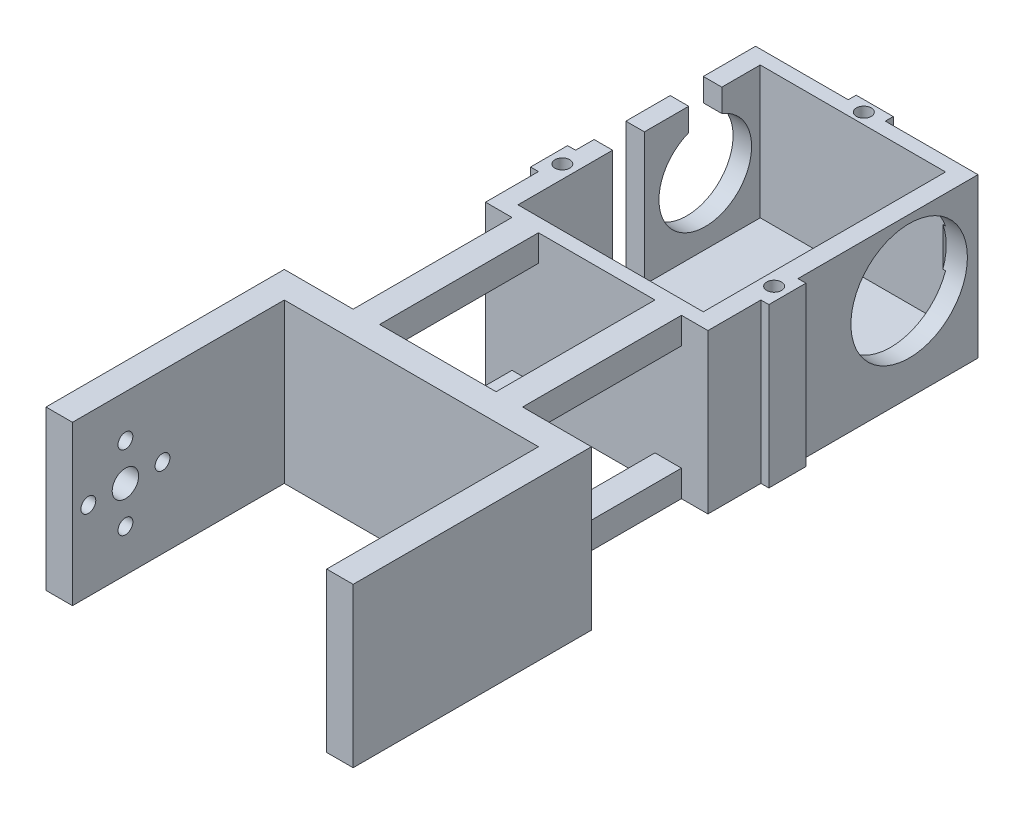
from build123d import *

# Parameters (mm, degrees)
BOSS_EXTRUDE1_DEPTH = 5
SKETCH3_W           = 42
SKETCH3_H           = 51
SKETCH3_W_2         = 35
SKETCH3_H_2         = 45.75
BOSS_EXTRUDE3_DEPTH = 25
SKETCH4_R           = 8.75
CUT_EXTRUDE2_DEPTH  = 5
CUT_EXTRUDE3_DEPTH  = 4
SKETCH7_W           = 6
SKETCH7_H           = 25
CUT_EXTRUDE4_DEPTH  = 4
SKETCH9_R           = 11
CUT_EXTRUDE5_DEPTH  = 4
SKETCH16_W          = 7
SKETCH16_H          = 30
BOSS_EXTRUDE5_DEPTH = 1.5
SKETCH17_W          = 7
SKETCH17_H          = 30
BOSS_EXTRUDE6_DEPTH = 1.5
SKETCH19_W          = 7
SKETCH19_H          = 30
BOSS_EXTRUDE7_DEPTH = 1.5
SKETCH18_R          = 1.4
CUT_EXTRUDE7_DEPTH  = 6
SKETCH1_3_W         = 5
SKETCH1_3_H         = 30
SKETCH1_3_H_2       = 40
BOSS_EXTRUDE8_DEPTH = 30
SKETCH21_R          = 2.95
BOSS_EXTRUDE9_DEPTH = 4
SKETCH24_W          = 30
SKETCH24_H          = 20
CUT_EXTRUDE8_DEPTH  = 32
SKETCH25_R          = 2.5
SKETCH25_R_2        = 1.4
CUT_EXTRUDE9_DEPTH  = 5


with BuildPart() as part:
    # Sketch1 → Boss-Extrude1 (new body)
    with BuildSketch(Plane(origin=(0, 0, 0), x_dir=(1, 0, 0), z_dir=(0, 1, 0))):
        Polygon((21, 25.5), (-21, 25.5), (-21, -25.5), (-16, -25.5), (-11, -25.5), (11, -25.5), (16, -25.5), (21, -25.5), align=None)
    extrude(amount=BOSS_EXTRUDE1_DEPTH)

    # Sketch3 → Boss-Extrude3 (add)
    with BuildSketch(Plane(origin=(0, 5, 0), x_dir=(1, 0, 0), z_dir=(0, 1, 0))):
        Rectangle(SKETCH3_W, SKETCH3_H)
        Rectangle(SKETCH3_W_2, SKETCH3_H_2, mode=Mode.SUBTRACT)
    extrude(amount=BOSS_EXTRUDE3_DEPTH)

    # Sketch4 → Cut-Extrude2 (cut)
    with BuildSketch(Plane.ZY.offset(21)):
        with Locations((-12.5, 17.5)):
            Circle(SKETCH4_R)
    extrude(amount=-CUT_EXTRUDE2_DEPTH, mode=Mode.SUBTRACT)

    # Sketch6 → Cut-Extrude3 (cut)
    with BuildSketch(Plane(origin=(-17.5, 0, 0), x_dir=(0, 0, -1), z_dir=(1, 0, 0))):
        with BuildLine():
            Line((9.375, 17.5), (9.375, 30))
            Line((9.375, 30), (15.625, 30))
            Line((15.625, 30), (15.625, 17.5))
            ThreePointArc((15.625, 17.5), (12.5, 14.375), (9.375, 17.5))
        make_face()
    extrude(amount=-CUT_EXTRUDE3_DEPTH, mode=Mode.SUBTRACT)

    # Sketch7 → Cut-Extrude4 (cut)
    with BuildSketch(Plane.ZY.offset(21)):
        with Locations((2, 17.5)):
            Rectangle(SKETCH7_W, SKETCH7_H)
    extrude(amount=-CUT_EXTRUDE4_DEPTH, mode=Mode.SUBTRACT)

    # Sketch9 → Cut-Extrude5 (cut)
    with BuildSketch(Plane(origin=(21, 0, 0), x_dir=(0, 0, -1), z_dir=(1, 0, 0))):
        with Locations((12.5, 17.5)):
            Circle(SKETCH9_R)
    extrude(amount=-CUT_EXTRUDE5_DEPTH, mode=Mode.SUBTRACT)

    # Sketch16 → Boss-Extrude5 (add)
    with BuildSketch(Plane.ZY.offset(21)):
        with Locations((12, 15)):
            Rectangle(SKETCH16_W, SKETCH16_H)
    extrude(amount=BOSS_EXTRUDE5_DEPTH)

    # Sketch17 → Boss-Extrude6 (add)
    with BuildSketch(Plane(origin=(21, 0, 0), x_dir=(0, 0, -1), z_dir=(1, 0, 0))):
        with Locations((-12, 15)):
            Rectangle(SKETCH17_W, SKETCH17_H)
    extrude(amount=BOSS_EXTRUDE6_DEPTH)

    # Sketch19 → Boss-Extrude7 (add)
    with BuildSketch(Plane(origin=(0, 0, -25.5), x_dir=(-1, 0, 0), z_dir=(0, 0, -1))):
        with Locations((0, 15)):
            Rectangle(SKETCH19_W, SKETCH19_H)
    extrude(amount=BOSS_EXTRUDE7_DEPTH)

    # Sketch18 → Cut-Extrude7 (cut)
    with BuildSketch(Plane(origin=(0, 30, 0), x_dir=(1, 0, 0), z_dir=(0, 1, 0))):
        with Locations((-20, -12)):
            Circle(SKETCH18_R)
        with Locations((20, -12)):
            Circle(SKETCH18_R)
        with Locations((0, 24.9375)):
            Circle(SKETCH18_R)
    extrude(amount=-CUT_EXTRUDE7_DEPTH, mode=Mode.SUBTRACT)

    # Sketch1<3> → Boss-Extrude8 (add)
    with BuildSketch(Plane(origin=(0, 0, 0), x_dir=(1, 0, 0), z_dir=(0, 1, 0))):
        with Locations((-13.5, -40.5)):
            Rectangle(SKETCH1_3_W, SKETCH1_3_H)
        with Locations((13.5, -40.5)):
            Rectangle(SKETCH1_3_W, SKETCH1_3_H)
        Polygon((-11, -55.5), (-16, -55.5), (-29, -55.5), (-29, -60.5), (-24, -60.5), (24, -60.5), (29, -60.5), (29, -55.5), (16, -55.5), (11, -55.5), align=None)
        with Locations((26.5, -80.5)):
            Rectangle(SKETCH1_3_W, SKETCH1_3_H_2)
        with Locations((-26.5, -80.5)):
            Rectangle(SKETCH1_3_W, SKETCH1_3_H_2)
    extrude(amount=BOSS_EXTRUDE8_DEPTH)

    # Sketch21 → Boss-Extrude9 (add)
    with BuildSketch(Plane.ZY.offset(-24)):
        with Locations((90.5, 15)):
            Circle(SKETCH21_R)
    extrude(amount=BOSS_EXTRUDE9_DEPTH)

    # Sketch24 → Cut-Extrude8 (cut)
    with BuildSketch(Plane.ZY.offset(16)):
        with Locations((40.5, 15)):
            Rectangle(SKETCH24_W, SKETCH24_H)
    extrude(amount=-CUT_EXTRUDE8_DEPTH, mode=Mode.SUBTRACT)

    # Sketch25 → Cut-Extrude9 (cut)
    with BuildSketch(Plane.ZY.offset(29)):
        with Locations((90.5, 15)):
            Circle(SKETCH25_R)
        with Locations((90.5, 22)):
            Circle(SKETCH25_R_2)
        with Locations((83.5, 15)):
            Circle(SKETCH25_R_2)
        with Locations((90.5, 8)):
            Circle(SKETCH25_R_2)
        with Locations((97.5, 15)):
            Circle(SKETCH25_R_2)
    extrude(amount=-CUT_EXTRUDE9_DEPTH, mode=Mode.SUBTRACT)


solid = part.part
